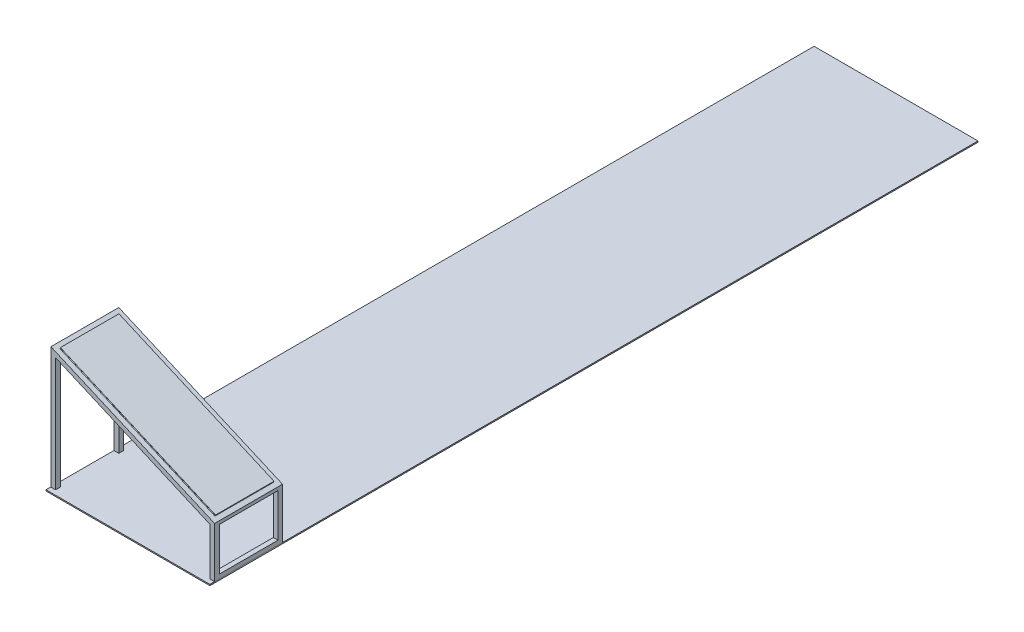
from build123d import *

# Parameters (mm, degrees)
SKETCH_1_W          = 1400
SKETCH_1_H          = 10
EXTRUDE_1_DEPTH     = 6560
EXTRUDE_START       = -40
EXTRUDE_2_DEPTH     = 580
CUT_EXTRUDE_START   = -962.442291
SKETCH_3_W          = 1444.708625949
SKETCH_3_H          = 500
CUT_EXTRUDE_2_DEPTH = 962.442291
SKETCH_4_W          = 497.60860418
SKETCH_4_H          = 367.181277729
CUT_EXTRUDE_3_DEPTH = 230
SKETCH_5_W          = 500
SKETCH_5_H          = 958.72545439
CUT_EXTRUDE_5_DEPTH = 103
SKETCH_6_W          = 1444.708625949
SKETCH_6_H          = 500
EXTRUDE_3_DEPTH     = 1


with BuildPart() as part:
    # 草圖1 → 填料-伸長1 (new body)
    with BuildSketch(Plane.XY):
        with Locations((700, 5)):
            Rectangle(SKETCH_1_W, SKETCH_1_H)
    extrude(amount=-EXTRUDE_1_DEPTH)


with BuildPart() as body_2:
    # 草圖2 → 填料-伸長2 (new body)
    with BuildSketch(Plane.XY.offset(EXTRUDE_START)):
        Polygon((1400, 10), (1400, 440.749309411), (299.527910738, 919.248192121), (1.750594072, 1048.72545439), (1.750594072, 10), (41.750594072, 10), (41.750594072, 987.715315229), (1360, 414.524160247), (1360, 10), align=None)
    extrude(amount=-EXTRUDE_2_DEPTH)

    # 草圖3 → 除料-伸長2 (cut)
    with BuildSketch(Plane(origin=(383.772967418, 882.617398947, 0), x_dir=(0.9170600743851266, -0.3987490689252403, 0), z_dir=(0.3987490689252403, 0.9170600743851266, 0)).offset(CUT_EXTRUDE_START)):
        with Locations((345.781414408, 330)):
            Rectangle(SKETCH_3_W, SKETCH_3_H)
    extrude(amount=CUT_EXTRUDE_2_DEPTH, mode=Mode.SUBTRACT)

    # 草圖4 → 除料-伸長3 (cut)
    with BuildSketch(Plane(origin=(1400, 0, 0), x_dir=(0, 0, -1), z_dir=(1, 0, 0))):
        with Locations((332.683013296, 229.483554348)):
            Rectangle(SKETCH_4_W, SKETCH_4_H)
    extrude(amount=-CUT_EXTRUDE_3_DEPTH, mode=Mode.SUBTRACT)

    # 草圖5 → 除料-伸長5 (cut)
    with BuildSketch(Plane(origin=(41.750594072, 0, 0), x_dir=(0, 0, -1), z_dir=(1, 0, 0))):
        with Locations((330, 529.362727195)):
            Rectangle(SKETCH_5_W, SKETCH_5_H)
    extrude(amount=-CUT_EXTRUDE_5_DEPTH, mode=Mode.SUBTRACT)


with BuildPart() as body_3:
    # 草圖6 → 填料-伸長3 (new body)
    with BuildSketch(Plane(origin=(387.760458107, 891.787999691, 0), x_dir=(0.9170600743851266, -0.3987490689252403, 0), z_dir=(0.3987490689252403, 0.9170600743851266, 0))):
        with Locations((345.781414408, 330)):
            Rectangle(SKETCH_6_W, SKETCH_6_H)
    extrude(amount=EXTRUDE_3_DEPTH)


solid = Compound([part.part, body_2.part, body_3.part])
